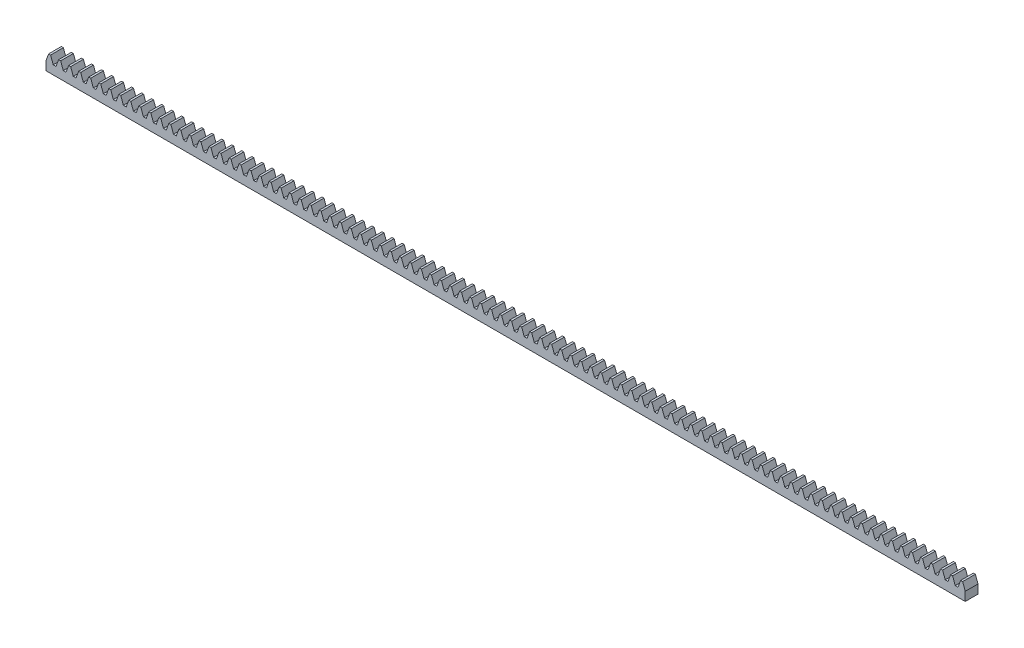
from build123d import *

# Parameters (mm, degrees)
BOSS_EXTRUDE1_DEPTH = 6.35
CUT_EXTRUDE1_DEPTH  = 329.359585831


with BuildPart() as part:
    # Sketch1 → Boss-Extrude1 (new body)
    with BuildSketch(Plane(origin=(0, 0, 46.616707813), x_dir=(-1, 0, 0), z_dir=(0, 0, -1))):
        Polygon((-180.783736362, -31.485414626), (-182.077418841, -35.039778024), (-182.077418841, -39.422914626), (325.922581159, -39.422914626), (325.922581159, -35.057289626), (325.22656501, -35.057289626), (323.926508829, -31.485414626), (322.931375157, -31.485414626), (321.631318977, -35.057289626), (320.239286678, -35.057289626), (318.939230498, -31.485414626), (317.944096825, -31.485414626), (316.644040645, -35.057289626), (315.252008346, -35.057289626), (313.951952166, -31.485414626), (312.956818494, -31.485414626), (311.656762313, -35.057289626), (310.264730014, -35.057289626), (308.964673834, -31.485414626), (307.969540162, -31.485414626), (306.669483981, -35.057289626), (305.277451682, -35.057289626), (303.977395502, -31.485414626), (302.98226183, -31.485414626), (301.682205649, -35.057289626), (300.290173351, -35.057289626), (298.99011717, -31.485414626), (297.994983498, -31.485414626), (296.694927317, -35.057289626), (295.302895019, -35.057289626), (294.002838838, -31.485414626), (293.007705166, -31.485414626), (291.707648986, -35.057289626), (290.315616687, -35.057289626), (289.015560506, -31.485414626), (288.020426834, -31.485414626), (286.720370654, -35.057289626), (285.328338355, -35.057289626), (284.028282174, -31.485414626), (283.033148502, -31.485414626), (281.733092322, -35.057289626), (280.341060023, -35.057289626), (279.041003843, -31.485414626), (278.04587017, -31.485414626), (276.74581399, -35.057289626), (275.353781691, -35.057289626), (274.053725511, -31.485414626), (273.058591839, -31.485414626), (271.758535658, -35.057289626), (270.366503359, -35.057289626), (269.066447179, -31.485414626), (268.071313507, -31.485414626), (266.771257326, -35.057289626), (265.379225027, -35.057289626), (264.079168847, -31.485414626), (263.084035175, -31.485414626), (261.783978994, -35.057289626), (260.391946696, -35.057289626), (259.091890515, -31.485414626), (258.096756843, -31.485414626), (256.796700662, -35.057289626), (255.404668364, -35.057289626), (254.104612183, -31.485414626), (253.109478511, -31.485414626), (251.809422331, -35.057289626), (250.417390032, -35.057289626), (249.117333851, -31.485414626), (248.122200179, -31.485414626), (246.822143999, -35.057289626), (245.4301117, -35.057289626), (244.130055519, -31.485414626), (243.134921847, -31.485414626), (241.834865667, -35.057289626), (240.442833368, -35.057289626), (239.142777188, -31.485414626), (238.147643515, -31.485414626), (236.847587335, -35.057289626), (235.455555036, -35.057289626), (234.155498856, -31.485414626), (233.160365184, -31.485414626), (231.860309003, -35.057289626), (230.468276704, -35.057289626), (229.168220524, -31.485414626), (228.173086852, -31.485414626), (226.873030671, -35.057289626), (225.480998372, -35.057289626), (224.180942192, -31.485414626), (223.18580852, -31.485414626), (221.885752339, -35.057289626), (220.493720041, -35.057289626), (219.19366386, -31.485414626), (218.198530188, -31.485414626), (216.898474007, -35.057289626), (215.506441709, -35.057289626), (214.206385528, -31.485414626), (213.211251856, -31.485414626), (211.911195676, -35.057289626), (210.519163377, -35.057289626), (209.219107196, -31.485414626), (208.223973524, -31.485414626), (206.923917344, -35.057289626), (205.531885045, -35.057289626), (204.231828864, -31.485414626), (203.236695192, -31.485414626), (201.936639012, -35.057289626), (200.544606713, -35.057289626), (199.244550533, -31.485414626), (198.24941686, -31.485414626), (196.94936068, -35.057289626), (195.557328381, -35.057289626), (194.257272201, -31.485414626), (193.262138529, -31.485414626), (191.962082348, -35.057289626), (190.570050049, -35.057289626), (189.269993869, -31.485414626), (188.274860197, -31.485414626), (186.974804016, -35.057289626), (185.582771717, -35.057289626), (184.282715537, -31.485414626), (183.287581865, -31.485414626), (181.987525684, -35.057289626), (180.595493386, -35.057289626), (179.295437205, -31.485414626), (178.300303533, -31.485414626), (177.000247352, -35.057289626), (175.608215054, -35.057289626), (174.308158873, -31.485414626), (173.313025201, -31.485414626), (172.012969021, -35.057289626), (170.620936722, -35.057289626), (169.320880541, -31.485414626), (168.325746869, -31.485414626), (167.025690689, -35.057289626), (165.63365839, -35.057289626), (164.333602209, -31.485414626), (163.338468537, -31.485414626), (162.038412357, -35.057289626), (160.646380058, -35.057289626), (159.346323878, -31.485414626), (158.351190205, -31.485414626), (157.051134025, -35.057289626), (155.659101726, -35.057289626), (154.359045546, -31.485414626), (153.363911874, -31.485414626), (152.063855693, -35.057289626), (150.671823394, -35.057289626), (149.371767214, -31.485414626), (148.376633542, -31.485414626), (147.076577361, -35.057289626), (145.684545062, -35.057289626), (144.384488882, -31.485414626), (143.38935521, -31.485414626), (142.089299029, -35.057289626), (140.697266731, -35.057289626), (139.39721055, -31.485414626), (138.402076878, -31.485414626), (137.102020697, -35.057289626), (135.709988399, -35.057289626), (134.409932218, -31.485414626), (133.414798546, -31.485414626), (132.114742366, -35.057289626), (130.722710067, -35.057289626), (129.422653886, -31.485414626), (128.427520214, -31.485414626), (127.127464034, -35.057289626), (125.735431735, -35.057289626), (124.435375554, -31.485414626), (123.440241882, -31.485414626), (122.140185702, -35.057289626), (120.748153403, -35.057289626), (119.448097223, -31.485414626), (118.45296355, -31.485414626), (117.15290737, -35.057289626), (115.760875071, -35.057289626), (114.460818891, -31.485414626), (113.465685219, -31.485414626), (112.165629038, -35.057289626), (110.773596739, -35.057289626), (109.473540559, -31.485414626), (108.478406887, -31.485414626), (107.178350706, -35.057289626), (105.786318407, -35.057289626), (104.486262227, -31.485414626), (103.491128555, -31.485414626), (102.191072374, -35.057289626), (100.799040076, -35.057289626), (99.498983895, -31.485414626), (98.503850223, -31.485414626), (97.203794042, -35.057289626), (95.811761744, -35.057289626), (94.511705563, -31.485414626), (93.516571891, -31.485414626), (92.216515711, -35.057289626), (90.824483412, -35.057289626), (89.524427231, -31.485414626), (88.529293559, -31.485414626), (87.229237379, -35.057289626), (85.83720508, -35.057289626), (84.537148899, -31.485414626), (83.542015227, -31.485414626), (82.241959047, -35.057289626), (80.849926748, -35.057289626), (79.549870568, -31.485414626), (78.554736895, -31.485414626), (77.254680715, -35.057289626), (75.862648416, -35.057289626), (74.562592236, -31.485414626), (73.567458564, -31.485414626), (72.267402383, -35.057289626), (70.875370084, -35.057289626), (69.575313904, -31.485414626), (68.580180232, -31.485414626), (67.280124051, -35.057289626), (65.888091752, -35.057289626), (64.588035572, -31.485414626), (63.5929019, -31.485414626), (62.292845719, -35.057289626), (60.900813421, -35.057289626), (59.60075724, -31.485414626), (58.605623568, -31.485414626), (57.305567387, -35.057289626), (55.913535089, -35.057289626), (54.613478908, -31.485414626), (53.618345236, -31.485414626), (52.318289056, -35.057289626), (50.926256757, -35.057289626), (49.626200576, -31.485414626), (48.631066904, -31.485414626), (47.331010724, -35.057289626), (45.938978425, -35.057289626), (44.638922244, -31.485414626), (43.643788572, -31.485414626), (42.343732392, -35.057289626), (40.951700093, -35.057289626), (39.651643913, -31.485414626), (38.65651024, -31.485414626), (37.35645406, -35.057289626), (35.964421761, -35.057289626), (34.664365581, -31.485414626), (33.669231909, -31.485414626), (32.369175728, -35.057289626), (30.977143429, -35.057289626), (29.677087249, -31.485414626), (28.681953577, -31.485414626), (27.381897396, -35.057289626), (25.989865097, -35.057289626), (24.689808917, -31.485414626), (23.694675245, -31.485414626), (22.394619064, -35.057289626), (21.002586766, -35.057289626), (19.702530585, -31.485414626), (18.707396913, -31.485414626), (17.407340732, -35.057289626), (16.015308434, -35.057289626), (14.715252253, -31.485414626), (13.720118581, -31.485414626), (12.420062401, -35.057289626), (11.028030102, -35.057289626), (9.727973921, -31.485414626), (8.732840249, -31.485414626), (7.432784069, -35.057289626), (6.04075177, -35.057289626), (4.740695589, -31.485414626), (3.745561917, -31.485414626), (2.445505737, -35.057289626), (1.053473438, -35.057289626), (-0.246582742, -31.485414626), (-1.241716415, -31.485414626), (-2.541772595, -35.057289626), (-3.933804894, -35.057289626), (-5.233861074, -31.485414626), (-6.228994746, -31.485414626), (-7.529050927, -35.057289626), (-8.921083226, -35.057289626), (-10.221139406, -31.485414626), (-11.216273078, -31.485414626), (-12.516329259, -35.057289626), (-13.908361558, -35.057289626), (-15.208417738, -31.485414626), (-16.20355141, -31.485414626), (-17.503607591, -35.057289626), (-18.895639889, -35.057289626), (-20.19569607, -31.485414626), (-21.190829742, -31.485414626), (-22.490885923, -35.057289626), (-23.882918221, -35.057289626), (-25.182974402, -31.485414626), (-26.178108074, -31.485414626), (-27.478164254, -35.057289626), (-28.870196553, -35.057289626), (-30.170252734, -31.485414626), (-31.165386406, -31.485414626), (-32.465442586, -35.057289626), (-33.857474885, -35.057289626), (-35.157531066, -31.485414626), (-36.152664738, -31.485414626), (-37.452720918, -35.057289626), (-38.844753217, -35.057289626), (-40.144809397, -31.485414626), (-41.13994307, -31.485414626), (-42.43999925, -35.057289626), (-43.832031549, -35.057289626), (-45.132087729, -31.485414626), (-46.127221401, -31.485414626), (-47.427277582, -35.057289626), (-48.819309881, -35.057289626), (-50.119366061, -31.485414626), (-51.114499733, -31.485414626), (-52.414555914, -35.057289626), (-53.806588213, -35.057289626), (-55.106644393, -31.485414626), (-56.101778065, -31.485414626), (-57.401834246, -35.057289626), (-58.793866544, -35.057289626), (-60.093922725, -31.485414626), (-61.089056397, -31.485414626), (-62.389112578, -35.057289626), (-63.781144876, -35.057289626), (-65.081201057, -31.485414626), (-66.076334729, -31.485414626), (-67.376390909, -35.057289626), (-68.768423208, -35.057289626), (-70.068479389, -31.485414626), (-71.063613061, -31.485414626), (-72.363669241, -35.057289626), (-73.75570154, -35.057289626), (-75.055757721, -31.485414626), (-76.050891393, -31.485414626), (-77.350947573, -35.057289626), (-78.742979872, -35.057289626), (-80.043036052, -31.485414626), (-81.038169725, -31.485414626), (-82.338225905, -35.057289626), (-83.730258204, -35.057289626), (-85.030314384, -31.485414626), (-86.025448056, -31.485414626), (-87.325504237, -35.057289626), (-88.717536536, -35.057289626), (-90.017592716, -31.485414626), (-91.012726388, -31.485414626), (-92.312782569, -35.057289626), (-93.704814868, -35.057289626), (-95.004871048, -31.485414626), (-96.00000472, -31.485414626), (-97.300060901, -35.057289626), (-98.692093199, -35.057289626), (-99.99214938, -31.485414626), (-100.987283052, -31.485414626), (-102.287339233, -35.057289626), (-103.679371531, -35.057289626), (-104.979427712, -31.485414626), (-105.974561384, -31.485414626), (-107.274617564, -35.057289626), (-108.666649863, -35.057289626), (-109.966706044, -31.485414626), (-110.961839716, -31.485414626), (-112.261895896, -35.057289626), (-113.653928195, -35.057289626), (-114.953984376, -31.485414626), (-115.949118048, -31.485414626), (-117.249174228, -35.057289626), (-118.641206527, -35.057289626), (-119.941262707, -31.485414626), (-120.93639638, -31.485414626), (-122.23645256, -35.057289626), (-123.628484859, -35.057289626), (-124.928541039, -31.485414626), (-125.923674711, -31.485414626), (-127.223730892, -35.057289626), (-128.615763191, -35.057289626), (-129.915819371, -31.485414626), (-130.910953043, -31.485414626), (-132.211009224, -35.057289626), (-133.603041523, -35.057289626), (-134.903097703, -31.485414626), (-135.898231375, -31.485414626), (-137.198287556, -35.057289626), (-138.590319854, -35.057289626), (-139.890376035, -31.485414626), (-140.885509707, -31.485414626), (-142.185565888, -35.057289626), (-143.577598186, -35.057289626), (-144.877654367, -31.485414626), (-145.872788039, -31.485414626), (-147.172844219, -35.057289626), (-148.564876518, -35.057289626), (-149.864932699, -31.485414626), (-150.860066371, -31.485414626), (-152.160122551, -35.057289626), (-153.55215485, -35.057289626), (-154.852211031, -31.485414626), (-155.847344703, -31.485414626), (-157.147400883, -35.057289626), (-158.539433182, -35.057289626), (-159.839489362, -31.485414626), (-160.834623035, -31.485414626), (-162.134679215, -35.057289626), (-163.526711514, -35.057289626), (-164.826767694, -31.485414626), (-165.821901366, -31.485414626), (-167.121957547, -35.057289626), (-168.513989846, -35.057289626), (-169.814046026, -31.485414626), (-170.809179698, -31.485414626), (-172.109235879, -35.057289626), (-173.501268178, -35.057289626), (-174.801324358, -31.485414626), (-175.79645803, -31.485414626), (-177.096514211, -35.057289626), (-178.488546509, -35.057289626), (-179.78860269, -31.485414626), align=None)
    extrude(amount=-BOSS_EXTRUDE1_DEPTH)

    # Sketch2 → Cut-Extrude1 (cut, through all)
    with BuildSketch(Plane.XY.offset(52.966707813)):
        Polygon((-325.922581159, -39.422914626), (-275.353781691, -39.422914626), (-275.353781691, -35.057289626), (-275.353781691, -29.039935994), (-325.922581159, -29.039935994), (-325.922581159, -35.057289626), align=None)
    extrude(amount=-CUT_EXTRUDE1_DEPTH, mode=Mode.SUBTRACT)


solid = part.part
